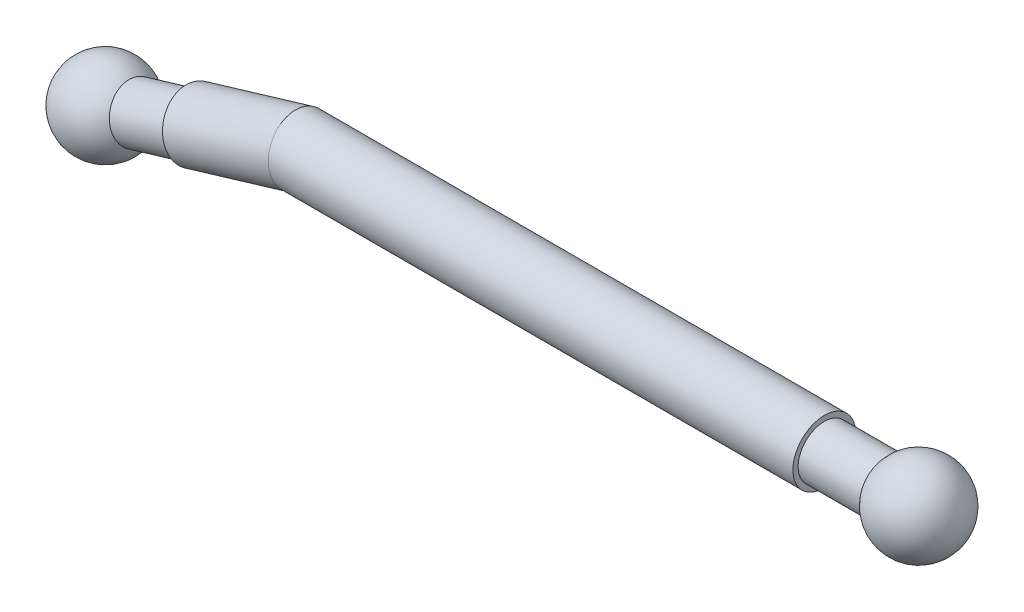
from build123d import *

# Parameters (mm, degrees)
SKETCH1_R           = 3
SKETCH3_R           = 2.5
BOSS_EXTRUDE1_DEPTH = 6
SKETCH5_R           = 2.5
BOSS_EXTRUDE2_DEPTH = 6


with BuildPart() as part:
    # Sweep2: sweep along a path in Sketch2
    with BuildLine(Plane.XY) as sweep2_path:
        Line((0, 0), (-50, 0))
        Line((-50, 0), (-60, -3))
    # Sketch1 → Sweep2 (sweep)
    with BuildSketch(Plane(origin=(0, 0, 0), x_dir=(0, 0, -1), z_dir=(1, 0, 0))):
        Circle(SKETCH1_R)
    sweep(path=sweep2_path.line, transition=Transition.RIGHT)

    # Sketch3 → Boss-Extrude1 (add)
    with BuildSketch(Plane(origin=(-55.871559633, -16.76146789, 0), x_dir=(0, 0, 1), z_dir=(-0.9578262852211515, -0.2873478855663453, 0))):
        with Locations(Location((0, 14.233174799, 0), (0, 0, 270))):
            Circle(SKETCH3_R)
    extrude(amount=BOSS_EXTRUDE1_DEPTH)

    # Sketch4 → Revolve1 (revolve)
    with BuildSketch(Plane(origin=(-64.4919962, -19.34759886, 0), x_dir=(0, 0, 1), z_dir=(-0.9578262852211515, -0.28734788556634533, 0))):
        with BuildLine():
            Line((0, 18.233174799), (0, 10.233174799))
            ThreePointArc((0, 10.233174799), (4, 14.233174799), (0, 18.233174799))
        make_face()
    revolve(axis=Axis((-69.731260426, -1.883384775, 0), (0.2873478855663463, -0.9578262852211512, 0)))

    # Sketch5 → Boss-Extrude2 (add)
    with BuildSketch(Plane(origin=(0, 0, 0), x_dir=(0, 0, -1), z_dir=(1, 0, 0))):
        Circle(SKETCH5_R)
    extrude(amount=BOSS_EXTRUDE2_DEPTH)

    # Sketch6 → Revolve2 (revolve)
    with BuildSketch(Plane(origin=(9, 0, 0), x_dir=(0, 0, -1), z_dir=(1, 0, 0))):
        with BuildLine():
            Line((0, 4), (0, -4))
            ThreePointArc((0, -4), (4, 0), (0, 4))
        make_face()
    revolve(axis=Axis((9, 4, 0), (0, -1, 0)))


solid = part.part
